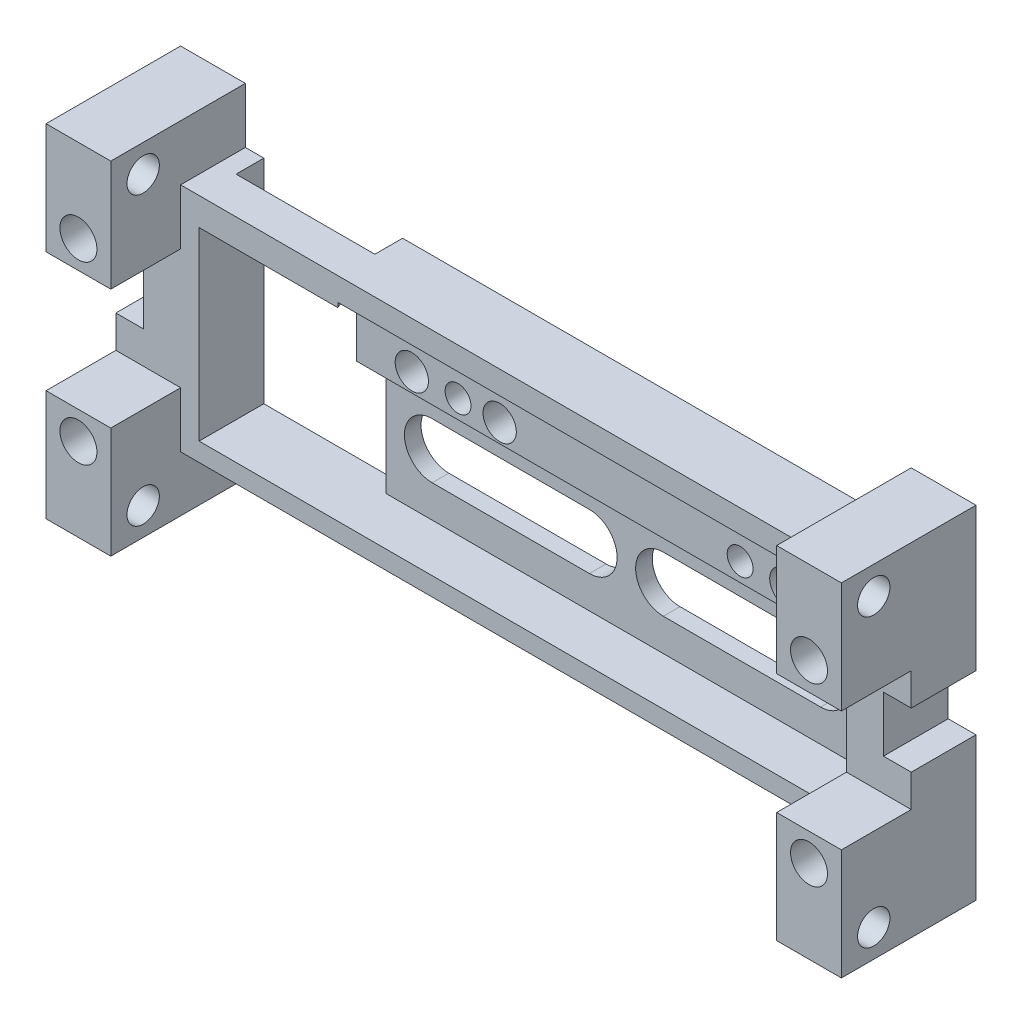
from build123d import *

# Parameters (mm, degrees)
SKETCH_1_W           = 86
SKETCH_1_H           = 25
EXTRUDE_1_DEPTH      = 7
SKETCH_2_W           = 15
SKETCH_2_H           = 17
CUT_EXTRUDE_1_DEPTH  = 90.833178726
SKETCH_3_W           = 55
SKETCH_3_H           = 13
CUT_EXTRUDE_2_DEPTH  = 5.2
SKETCH_4_W           = 55
SKETCH_4_H           = 7.5
CUT_EXTRUDE_3_DEPTH  = 2
CHAMFER_1_SIZE       = 1
SKETCH_5_R           = 1.8
CUT_EXTRUDE_4_DEPTH  = 90.699498326
SKETCH_6_R           = 1.4
CUT_EXTRUDE_5_DEPTH  = 90.699498326
CUT_EXTRUDE_6_DEPTH  = 90.710868907
SKETCH_8_W           = 7
SKETCH_8_H           = 6
EXTRUDE_2_DEPTH      = 7.55
SKETCH_9_R           = 2
CUT_EXTRUDE_7_DEPTH  = 91.734241056
SKETCH_10_W          = 14.55
SKETCH_10_H          = 6
SKETCH_10_R          = 1.75
EXTRUDE_3_DEPTH      = 7
EXTRUDE_START        = -7
SKETCH_12_W          = 14.55
SKETCH_12_H          = 6
SKETCH_12_R          = 1.75
EXTRUDE_5_DEPTH      = 7
SKETCH_13_W          = 7
SKETCH_13_H          = 6
CUT_EXTRUDE_8_DEPTH  = 3
SKETCH_14_W          = 7
SKETCH_14_H          = 6
CUT_EXTRUDE_9_DEPTH  = 3
CUT_EXTRUDE_10_DEPTH = 15


with BuildPart() as part:
    # 草图1 → 凸台-拉伸1 (new body)
    with BuildSketch(Plane.XY):
        with Locations((43, 12.5)):
            Rectangle(SKETCH_1_W, SKETCH_1_H)
    extrude(amount=EXTRUDE_1_DEPTH)

    # 草图2 → 切除-拉伸1 (cut, through all)
    with BuildSketch(Plane.XY.offset(7)):
        with Locations((16.5, 10.5)):
            Rectangle(SKETCH_2_W, SKETCH_2_H)
    extrude(amount=-CUT_EXTRUDE_1_DEPTH, mode=Mode.SUBTRACT)

    # 草图3 → 切除-拉伸2 (cut)
    with BuildSketch(Plane.XY.offset(7)):
        with Locations((51.5, 8.5)):
            Rectangle(SKETCH_3_W, SKETCH_3_H)
    extrude(amount=-CUT_EXTRUDE_2_DEPTH, mode=Mode.SUBTRACT)

    # 草图4 → 切除-拉伸3 (cut)
    with BuildSketch(Plane.XY.offset(7)):
        with Locations((51.5, 18.75)):
            Rectangle(SKETCH_4_W, SKETCH_4_H)
    extrude(amount=-CUT_EXTRUDE_3_DEPTH, mode=Mode.SUBTRACT)

    # 倒角1
    chamfer_1_edges = [part.edges().sort_by_distance(p)[0] for p in [
        (51.5, 15, 5),
    ]]
    chamfer(chamfer_1_edges, length=CHAMFER_1_SIZE)

    # 草图5 → 切除-拉伸4 (cut, through all)
    with BuildSketch(Plane.XY.offset(5)):
        with Locations((30, 18)):
            Circle(SKETCH_5_R)
        with Locations((39.5, 18)):
            Circle(SKETCH_5_R)
        with Locations((70.5, 18)):
            Circle(SKETCH_5_R)
    extrude(amount=-CUT_EXTRUDE_4_DEPTH, mode=Mode.SUBTRACT)

    # 草图6 → 切除-拉伸5 (cut, through all)
    with BuildSketch(Plane.XY.offset(5)):
        with Locations((35, 18)):
            Circle(SKETCH_6_R)
        with Locations((65.5, 18)):
            Circle(SKETCH_6_R)
    extrude(amount=-CUT_EXTRUDE_5_DEPTH, mode=Mode.SUBTRACT)

    # 草图7 → 切除-拉伸6 (cut, through all)
    with BuildSketch(Plane.XY.offset(1.8)):
        with BuildLine():
            Line((29, 11.5), (46, 11.5))
            ThreePointArc((46, 11.5), (49, 8.5), (46, 5.5))
            Line((46, 5.5), (29, 5.5))
            ThreePointArc((29, 5.5), (26, 8.5), (29, 11.5))
        make_face()
        with BuildLine():
            Line((54, 11.5), (71, 11.5))
            ThreePointArc((71, 11.5), (74, 8.5), (71, 5.5))
            Line((71, 5.5), (54, 5.5))
            ThreePointArc((54, 5.5), (51, 8.5), (54, 11.5))
        make_face()
    extrude(amount=-CUT_EXTRUDE_6_DEPTH, mode=Mode.SUBTRACT)

    # 草图8 → 凸台-拉伸2 (add)
    with BuildSketch(Plane.XY.offset(7)):
        with Locations((3.5, 22)):
            Rectangle(SKETCH_8_W, SKETCH_8_H)
        with Locations((82.5, 3)):
            Rectangle(SKETCH_8_W, SKETCH_8_H)
        with Locations((3.5, 3)):
            Rectangle(SKETCH_8_W, SKETCH_8_H)
        with Locations((82.5, 22)):
            Rectangle(SKETCH_8_W, SKETCH_8_H)
    extrude(amount=EXTRUDE_2_DEPTH)

    # 草图9 → 切除-拉伸7 (cut, through all)
    with BuildSketch(Plane.XY.offset(14.55)):
        with Locations((3.5, 22)):
            Circle(SKETCH_9_R)
        with Locations((82.5, 3)):
            Circle(SKETCH_9_R)
        with Locations((82.5, 22)):
            Circle(SKETCH_9_R)
        with Locations((3.5, 3)):
            Circle(SKETCH_9_R)
    extrude(amount=-CUT_EXTRUDE_7_DEPTH, mode=Mode.SUBTRACT)

    # 草图10 → 凸台-拉伸3 (add)
    # profile 1 of 2: a face of its own
    with BuildSketch(Plane.ZY):
        with Locations((7.275, 28)):
            Rectangle(SKETCH_10_W, SKETCH_10_H)
        with Locations((11.05, 28)):
            Circle(SKETCH_10_R, mode=Mode.SUBTRACT)
    # profile 2 of 2: a face of its own
    with BuildSketch(Plane.ZY):
        with Locations((7.275, -3)):
            Rectangle(SKETCH_10_W, SKETCH_10_H)
        with Locations((11.05, -3)):
            Circle(SKETCH_10_R, mode=Mode.SUBTRACT)
    extrude(amount=-EXTRUDE_3_DEPTH)

    # 草图12 → 凸台-拉伸5 (add)
    # profile 1 of 2: a face of its own
    with BuildSketch(Plane(origin=(86, 0, 0), x_dir=(0, 0, -1), z_dir=(1, 0, 0)).offset(EXTRUDE_START)):
        with Locations((-7.275, 28)):
            Rectangle(SKETCH_12_W, SKETCH_12_H)
        with Locations(Location((-11.05, 28, 0), (0, 0, 180))):
            Circle(SKETCH_12_R, mode=Mode.SUBTRACT)
    # profile 2 of 2: a face of its own
    with BuildSketch(Plane(origin=(86, 0, 0), x_dir=(0, 0, -1), z_dir=(1, 0, 0)).offset(EXTRUDE_START)):
        with Locations((-7.275, -3)):
            Rectangle(SKETCH_12_W, SKETCH_12_H)
        with Locations(Location((-11.05, -3, 0), (0, 0, 180))):
            Circle(SKETCH_12_R, mode=Mode.SUBTRACT)
    extrude(amount=EXTRUDE_5_DEPTH)

    # 草图13 → 切除-拉伸8 (cut)
    with BuildSketch(Plane.ZY):
        with Locations((3.5, 12.5)):
            Rectangle(SKETCH_13_W, SKETCH_13_H)
    extrude(amount=-CUT_EXTRUDE_8_DEPTH, mode=Mode.SUBTRACT)

    # 草图14 → 切除-拉伸9 (cut)
    with BuildSketch(Plane(origin=(86, 0, 0), x_dir=(0, 0, -1), z_dir=(1, 0, 0))):
        with Locations((-3.5, 12.5)):
            Rectangle(SKETCH_14_W, SKETCH_14_H)
    extrude(amount=-CUT_EXTRUDE_9_DEPTH, mode=Mode.SUBTRACT)

    # 草图20 → 切除-拉伸10 (cut)
    with BuildSketch(Plane.ZY.offset(-24)):
        Polygon((0, 19), (7, 19), (7, 22), (3, 25), (0, 25), align=None)
    extrude(amount=CUT_EXTRUDE_10_DEPTH, mode=Mode.SUBTRACT)


solid = part.part
